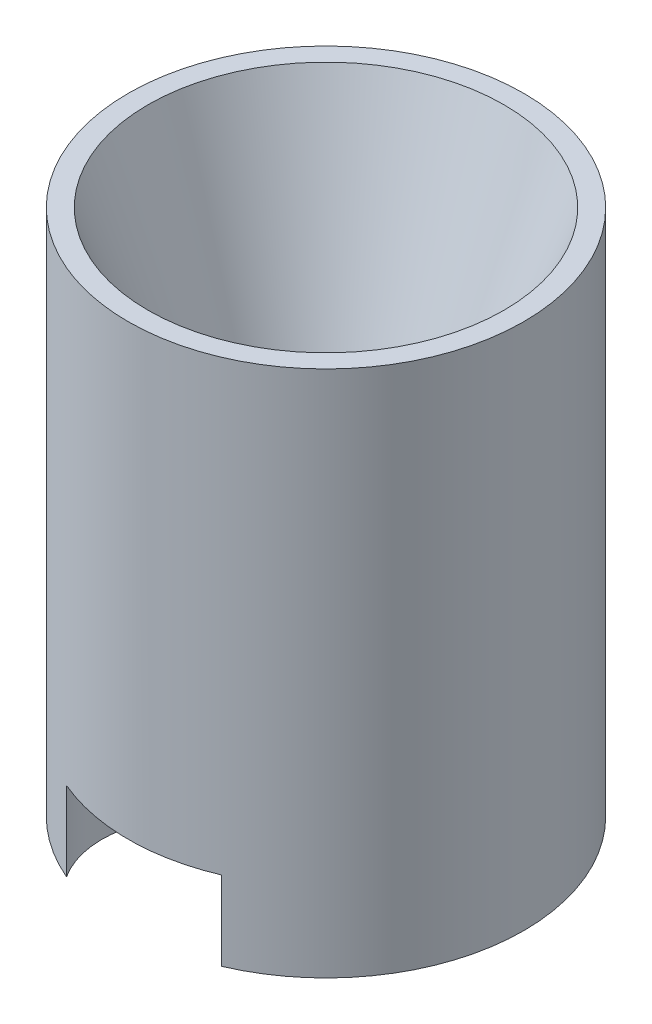
from build123d import *

# Parameters (mm, degrees)
SKETCH1_R           = 7.5
SKETCH1_R_2         = 0.75
BOSS_EXTRUDE1_DEPTH = 20
CHAMFER1_SIZE       = 6
CHAMFER1_SIZE2      = 16.484864517
SKETCH2_R           = 3.5
CUT_EXTRUDE1_DEPTH  = 3


with BuildPart() as part:
    # Sketch1 → Boss-Extrude1 (new body)
    with BuildSketch(Plane(origin=(0, 0, 0), x_dir=(1, 0, 0), z_dir=(0, 1, 0))):
        with Locations(Location((0, 0, 0), (0, 0, 270))):
            Circle(SKETCH1_R)
        with Locations(Location((0, 0, 0), (0, 0, 270))):
            Circle(SKETCH1_R_2, mode=Mode.SUBTRACT)
    extrude(amount=BOSS_EXTRUDE1_DEPTH)

    # Chamfer1
    chamfer1_edges = [part.edges().sort_by_distance(p)[0] for p in [
        (0, 20, -0.75),
    ]]
    chamfer1_side = [part.faces().sort_by_distance(p)[0] for p in [
        (0, 20, -7.287867966),
    ]]
    chamfer(chamfer1_edges, length=CHAMFER1_SIZE, length2=CHAMFER1_SIZE2, reference=chamfer1_side[0])

    # Sketch2 → Cut-Extrude1 (cut)
    with BuildSketch(Plane.XZ):
        with Locations((0, 5)):
            Circle(SKETCH2_R)
    extrude(amount=-CUT_EXTRUDE1_DEPTH, mode=Mode.SUBTRACT)


solid = part.part
